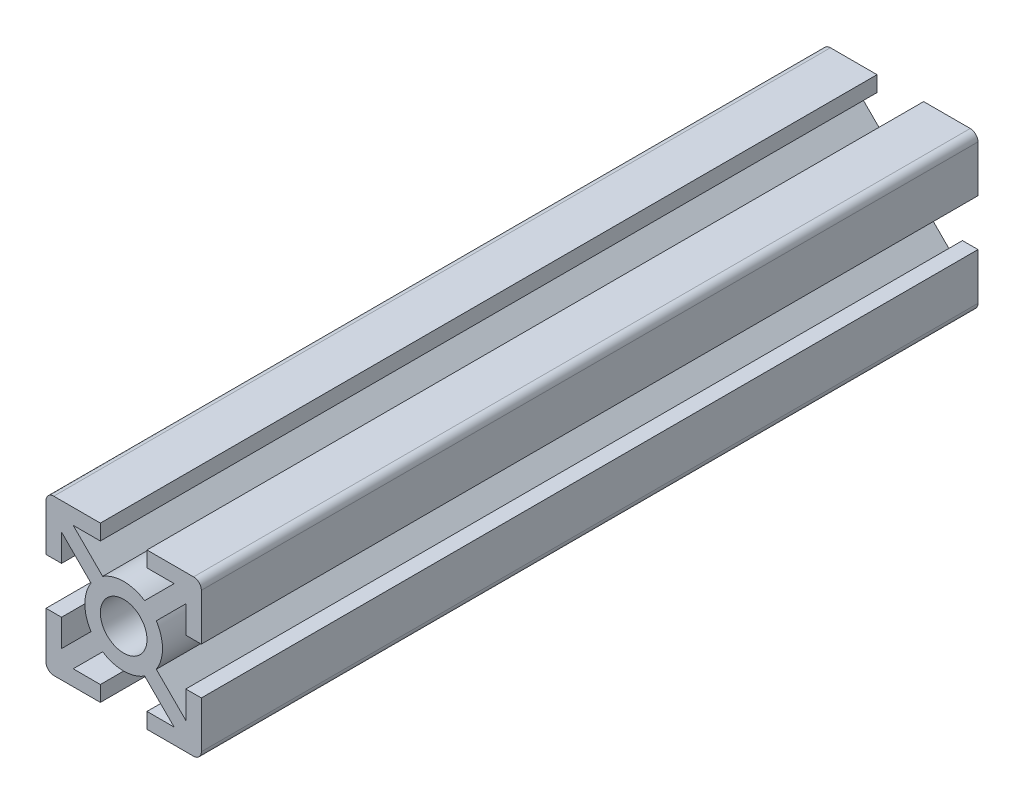
from build123d import *

# Parameters (mm, degrees)
CROQUIS2_R              = 3
SALIENTE_EXTRUIR2_DEPTH = 100
REDONDEO2_R             = 1


with BuildPart() as part:
    # Croquis2 → Saliente-Extruir2 (new body)
    with BuildSketch(Plane.XY):
        with BuildLine():
            Line((-10, 10), (-3, 10))
            Line((-3, 10), (-3, 8))
            Line((-3, 8), (-6.5, 8))
            Line((-6.5, 8), (-2.70506874, 4.20506874))
            ThreePointArc((-2.70506874, 4.20506874), (0, 5), (2.70506874, 4.20506874))
            Line((2.70506874, 4.20506874), (6.5, 8))
            Line((6.5, 8), (3, 8))
            Line((3, 8), (3, 10))
            Line((3, 10), (10, 10))
            Line((10, 10), (10, 3))
            Line((10, 3), (8, 3))
            Line((8, 3), (8, 6.5))
            Line((8, 6.5), (4.20506874, 2.70506874))
            ThreePointArc((4.20506874, 2.70506874), (5, 0), (4.20506874, -2.70506874))
            Line((4.20506874, -2.70506874), (8, -6.5))
            Line((8, -6.5), (8, -3))
            Line((8, -3), (10, -3))
            Line((10, -3), (10, -10))
            Line((10, -10), (3, -10))
            Line((3, -10), (3, -8))
            Line((3, -8), (6.5, -8))
            Line((6.5, -8), (2.70506874, -4.20506874))
            ThreePointArc((2.70506874, -4.20506874), (0, -5), (-2.70506874, -4.20506874))
            Line((-2.70506874, -4.20506874), (-6.5, -8))
            Line((-6.5, -8), (-3, -8))
            Line((-3, -8), (-3, -10))
            Line((-3, -10), (-10, -10))
            Line((-10, -10), (-10, -3))
            Line((-10, -3), (-8, -3))
            Line((-8, -3), (-8, -6.5))
            Line((-8, -6.5), (-4.20506874, -2.70506874))
            ThreePointArc((-4.20506874, -2.70506874), (-5, 0), (-4.20506874, 2.70506874))
            Line((-4.20506874, 2.70506874), (-8, 6.5))
            Line((-8, 6.5), (-8, 3))
            Line((-8, 3), (-10, 3))
            Line((-10, 3), (-10, 10))
        make_face()
        Circle(CROQUIS2_R, mode=Mode.SUBTRACT)
    extrude(amount=SALIENTE_EXTRUIR2_DEPTH)

    # Redondeo2
    redondeo2_edges = [part.edges().sort_by_distance(p)[0] for p in [
        (-10, 10, 50),
        (10, 10, 50),
        (10, -10, 50),
        (-10, -10, 50),
    ]]
    fillet(redondeo2_edges, radius=REDONDEO2_R)


solid = part.part
